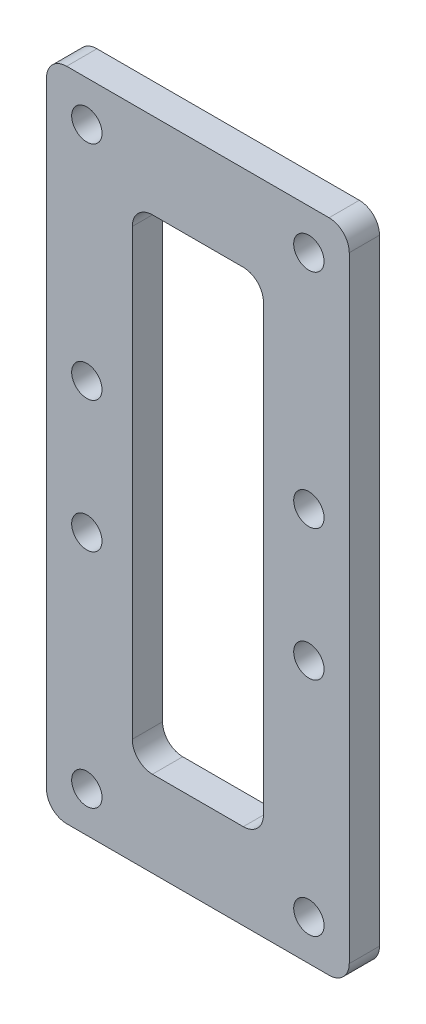
from build123d import *

# Parameters (mm, degrees)
SKETCH_1_W          = 30
SKETCH_1_H          = 65
EXTRUDE_1_DEPTH     = 3
SKETCH_2_R          = 1.505
CUT_EXTRUDE_1_DEPTH = 3
FILLET_1_R          = 2
SKETCH_3_W          = 13
SKETCH_3_H          = 48
CUT_EXTRUDE_2_DEPTH = 10
FILLET_2_R          = 2


with BuildPart() as part:
    # 草图1 → 凸台-拉伸1 (new body)
    with BuildSketch(Plane.XY):
        Rectangle(SKETCH_1_W, SKETCH_1_H)
    extrude(amount=EXTRUDE_1_DEPTH)

    # 草图2 → 切除-拉伸1 (cut)
    with BuildSketch(Plane.XY.offset(3)):
        with Locations((-11, 28.5)):
            Circle(SKETCH_2_R)
        with Locations((11, 28.5)):
            Circle(SKETCH_2_R)
        with Locations((-11, 6.5)):
            Circle(SKETCH_2_R)
        with Locations((11, 6.5)):
            Circle(SKETCH_2_R)
    cut_extrude_1 = extrude(amount=-CUT_EXTRUDE_1_DEPTH, mode=Mode.SUBTRACT)

    # 镜向1: 切除-拉伸1 across plane
    add(cut_extrude_1.mirror(Plane.ZX), mode=Mode.SUBTRACT)

    # 圆角1
    fillet_1_edges = [part.edges().sort_by_distance(p)[0] for p in [
        (15, -32.5, 1.5),
        (-15, -32.5, 1.5),
        (-15, 32.5, 1.5),
        (15, 32.5, 1.5),
    ]]
    fillet(fillet_1_edges, radius=FILLET_1_R)

    # 草图3 → 切除-拉伸2 (cut)
    with BuildSketch(Plane.XY.offset(3)):
        Rectangle(SKETCH_3_W, SKETCH_3_H)
    extrude(amount=-CUT_EXTRUDE_2_DEPTH, mode=Mode.SUBTRACT)

    # 圆角2
    fillet_2_edges = [part.edges().sort_by_distance(p)[0] for p in [
        (6.5, 24, 1.5),
        (6.5, -24, 1.5),
        (-6.5, -24, 1.5),
        (-6.5, 24, 1.5),
    ]]
    fillet(fillet_2_edges, radius=FILLET_2_R)


solid = part.part
